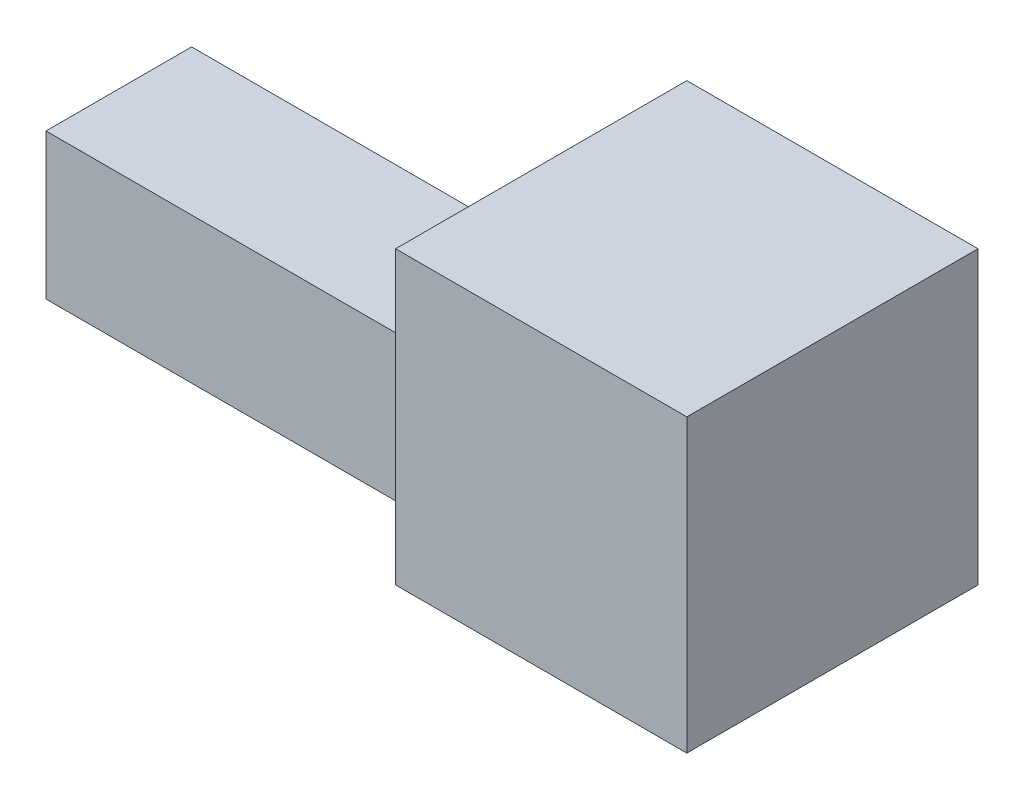
from build123d import *

# Parameters (mm, degrees)
SKETCH3_W           = 20
SKETCH3_H           = 20
BOSS_EXTRUDE2_DEPTH = 20
SKETCH1_W           = 30
SKETCH1_H           = 10
BOSS_EXTRUDE3_DEPTH = 10


with BuildPart() as part:
    # Sketch3 → Boss-Extrude2 (new body)
    with BuildSketch(Plane(origin=(0, 0, 0), x_dir=(1, 0, 0), z_dir=(0, 1, 0))):
        with Locations((24.014133178, 0)):
            Rectangle(SKETCH3_W, SKETCH3_H)
    extrude(amount=BOSS_EXTRUDE2_DEPTH)


with BuildPart() as body_2:
    # Sketch1 → Boss-Extrude3 (new body)
    with BuildSketch(Plane(origin=(0, 0, 0), x_dir=(1, 0, 0), z_dir=(0, 1, 0))):
        Rectangle(SKETCH1_W, SKETCH1_H)
    extrude(amount=BOSS_EXTRUDE3_DEPTH)


solid = Compound([part.part, body_2.part])
